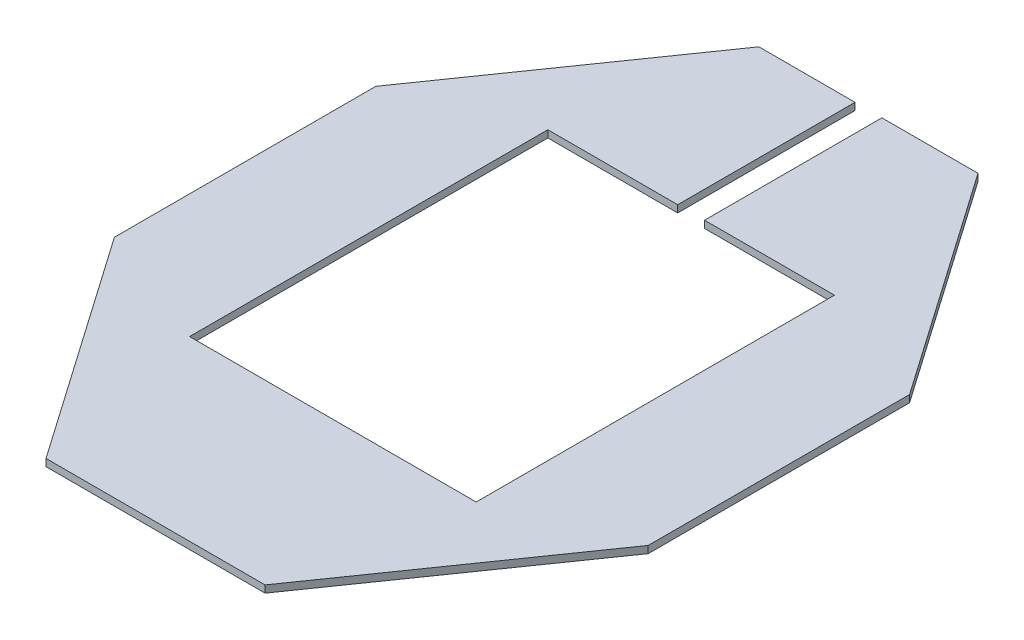
from build123d import *

# Parameters (mm, degrees)
SKETCH1_W           = 33
SKETCH1_H           = 43
BOSS_EXTRUDE1_DEPTH = 0.65
CUT_EXTRUDE1_DEPTH  = 0.25
SKETCH3_W           = 16
SKETCH3_H           = 20
CUT_EXTRUDE2_DEPTH  = 4.125
CUT_EXTRUDE3_DEPTH  = 4.125
SKETCH5_W           = 1.5
SKETCH5_H           = 10
CUT_EXTRUDE4_DEPTH  = 10
SKETCH6_W           = 7.307736582
SKETCH6_H           = 22.967172114
SKETCH6_W_2         = 20.795730386
SKETCH6_H_2         = 8.393457445
SKETCH6_W_3         = 19.542864514
SKETCH6_H_3         = 6.295941965
SKETCH6_W_4         = 6.096070792
CUT_EXTRUDE5_DEPTH  = 5


with BuildPart() as part:
    # Sketch1 → Boss-Extrude1 (new body)
    with BuildSketch(Plane(origin=(0, 0, 0), x_dir=(1, 0, 0), z_dir=(0, 1, 0))):
        Rectangle(SKETCH1_W, SKETCH1_H)
    extrude(amount=BOSS_EXTRUDE1_DEPTH)

    # Sketch2 → Cut-Extrude1 (cut)
    with BuildSketch(Plane.XZ):
        Polygon((5, 21.5), (16.5, 21.5), (16.5, 5), (15, 5), (15, -5), (16.5, -5), (16.5, -21.5), (5, -21.5), (5, -20), (-5, -20), (-5, -21.5), (-16.5, -21.5), (-16.5, -5), (-15, -5), (-15, 5), (-16.5, 5), (-16.5, 21.5), (-5, 21.5), (-5, 20), (5, 20), align=None)
    extrude(amount=-CUT_EXTRUDE1_DEPTH, mode=Mode.SUBTRACT)

    # Sketch3 → Cut-Extrude2 (cut)
    with BuildSketch(Plane.XZ.offset(-0.25)):
        Rectangle(SKETCH3_W, SKETCH3_H)
    extrude(amount=-CUT_EXTRUDE2_DEPTH, mode=Mode.SUBTRACT)

    # Sketch4 → Cut-Extrude3 (cut)
    with BuildSketch(Plane.XZ.offset(-0.25)):
        Polygon((-5, 21.5), (-16.5, 5), (-16.5, 21.5), align=None)
        Polygon((5, 21.5), (16.5, 5), (16.5, 21.5), align=None)
        Polygon((-16.5, -5), (-5, -21.5), (-16.5, -21.5), align=None)
        Polygon((16.5, -5), (5, -21.5), (16.5, -21.5), align=None)
    extrude(amount=-CUT_EXTRUDE3_DEPTH, mode=Mode.SUBTRACT)

    # Sketch5 → Cut-Extrude4 (cut)
    with BuildSketch(Plane.XZ.offset(-0.25)):
        with Locations((0, -15)):
            Rectangle(SKETCH5_W, SKETCH5_H)
    extrude(amount=-CUT_EXTRUDE4_DEPTH, mode=Mode.SUBTRACT)

    # Sketch6 → Cut-Extrude5 (cut, symmetric)
    with BuildSketch(Plane.XZ.offset(-0.25)):
        with Locations((18.553868291, 0.304489024)):
            Rectangle(SKETCH6_W, SKETCH6_H)
        with Locations((0.125275484, 24.096728723)):
            Rectangle(SKETCH6_W_2, SKETCH6_H_2)
        with Locations((-0.501157452, -23.047970983)):
            Rectangle(SKETCH6_W_3, SKETCH6_H_3)
        with Locations((-17.948035396, 0.304489024)):
            Rectangle(SKETCH6_W_4, SKETCH6_H)
    extrude(amount=CUT_EXTRUDE5_DEPTH, both=True, mode=Mode.SUBTRACT)


solid = part.part
